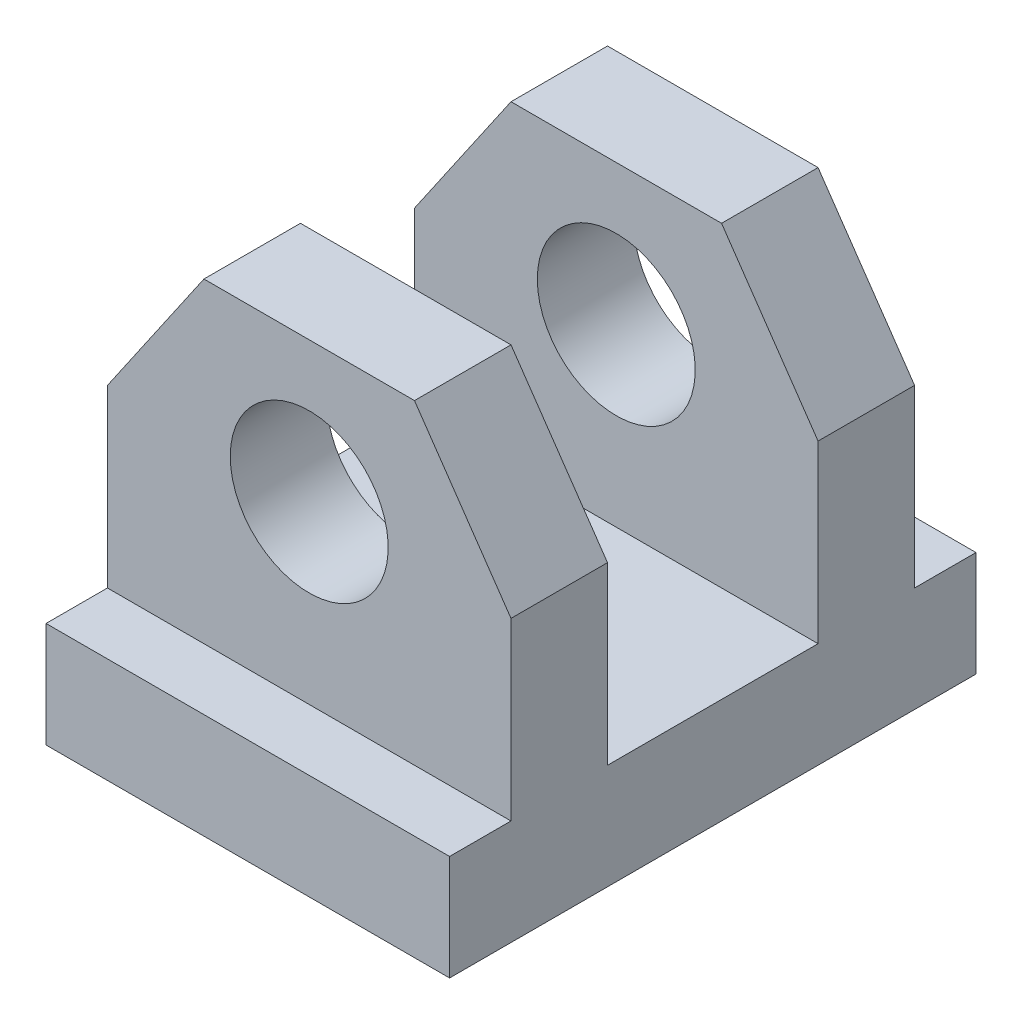
from build123d import *

# Parameters (mm, degrees)
CROQUIS2_R              = 9
SALIENTE_EXTRUIR2_DEPTH = 60
CROQUIS3_W              = 46
CROQUIS3_H              = 7
CORTAR_EXTRUIR2_DEPTH   = 36
CROQUIS4_W              = 63.672902111
CROQUIS4_H              = 24
CORTAR_EXTRUIR3_DEPTH   = 36


with BuildPart() as part:
    # Croquis2 → Saliente-Extruir2 (new body)
    with BuildSketch(Plane.XY):
        Polygon((-23, 0), (23, 0), (23, 32), (12, 48), (-12, 48), (-23, 32), align=None)
        with Locations((0, 32)):
            Circle(CROQUIS2_R, mode=Mode.SUBTRACT)
    extrude(amount=SALIENTE_EXTRUIR2_DEPTH)

    # Croquis3 → Cortar-Extruir2 (cut)
    with BuildSketch(Plane(origin=(0, 48, 0), x_dir=(1, 0, 0), z_dir=(0, 1, 0))):
        with Locations((0, -3.5)):
            Rectangle(CROQUIS3_W, CROQUIS3_H)
        with Locations((0, -56.5)):
            Rectangle(CROQUIS3_W, CROQUIS3_H)
    extrude(amount=-CORTAR_EXTRUIR2_DEPTH, mode=Mode.SUBTRACT)

    # Croquis4 → Cortar-Extruir3 (cut)
    with BuildSketch(Plane(origin=(0, 48, 0), x_dir=(1, 0, 0), z_dir=(0, 1, 0))):
        with Locations((8.836451055, -30)):
            Rectangle(CROQUIS4_W, CROQUIS4_H)
    extrude(amount=-CORTAR_EXTRUIR3_DEPTH, mode=Mode.SUBTRACT)


solid = part.part
